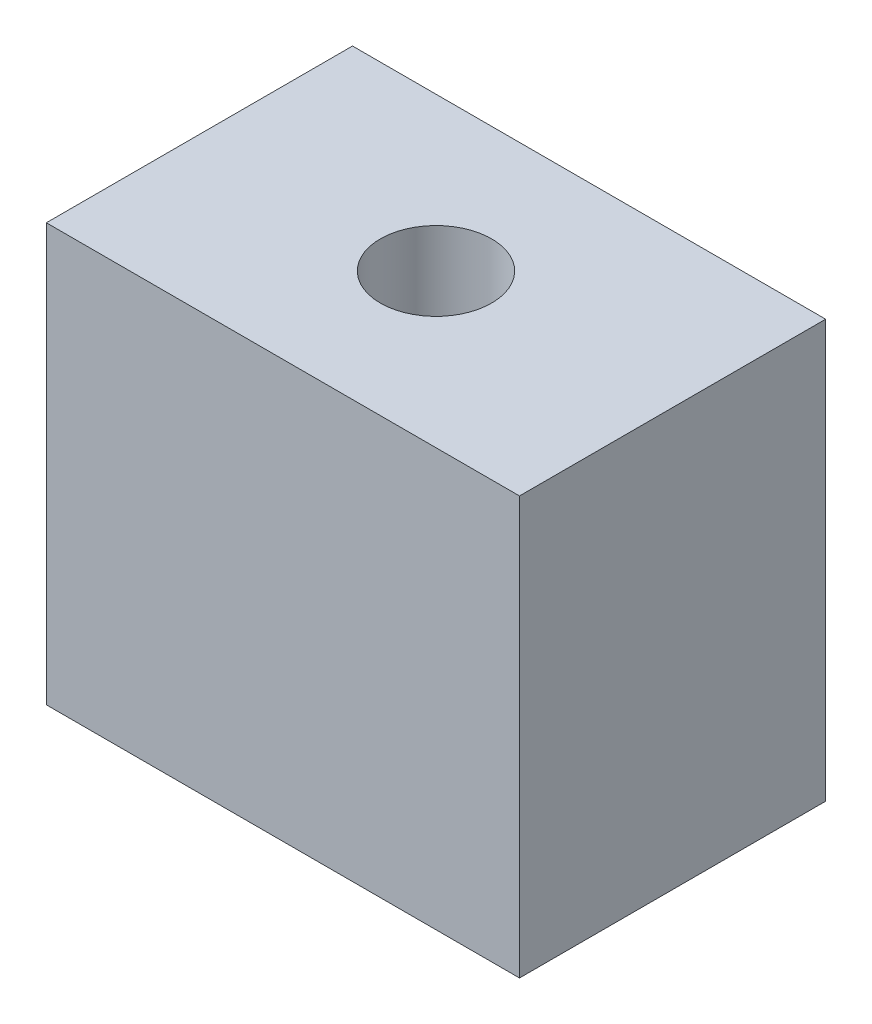
from build123d import *

# Parameters (mm, degrees)
SKETCH1_W           = 34
SKETCH1_H           = 30
BOSS_EXTRUDE1_DEPTH = 22
SKETCH2_R           = 4
CUT_EXTRUDE1_DEPTH  = 30


with BuildPart() as part:
    # Sketch1 → Boss-Extrude1 (new body)
    with BuildSketch(Plane.XY):
        Rectangle(SKETCH1_W, SKETCH1_H)
    extrude(amount=BOSS_EXTRUDE1_DEPTH)

    # Sketch2 → Cut-Extrude1 (cut)
    with BuildSketch(Plane(origin=(0, 15, 0), x_dir=(-1, 0, 0), z_dir=(0, 1, 0))):
        with Locations(Location((0, 11, 0), (0, 0, 90))):
            Circle(SKETCH2_R)
    extrude(amount=-CUT_EXTRUDE1_DEPTH, mode=Mode.SUBTRACT)


solid = part.part
